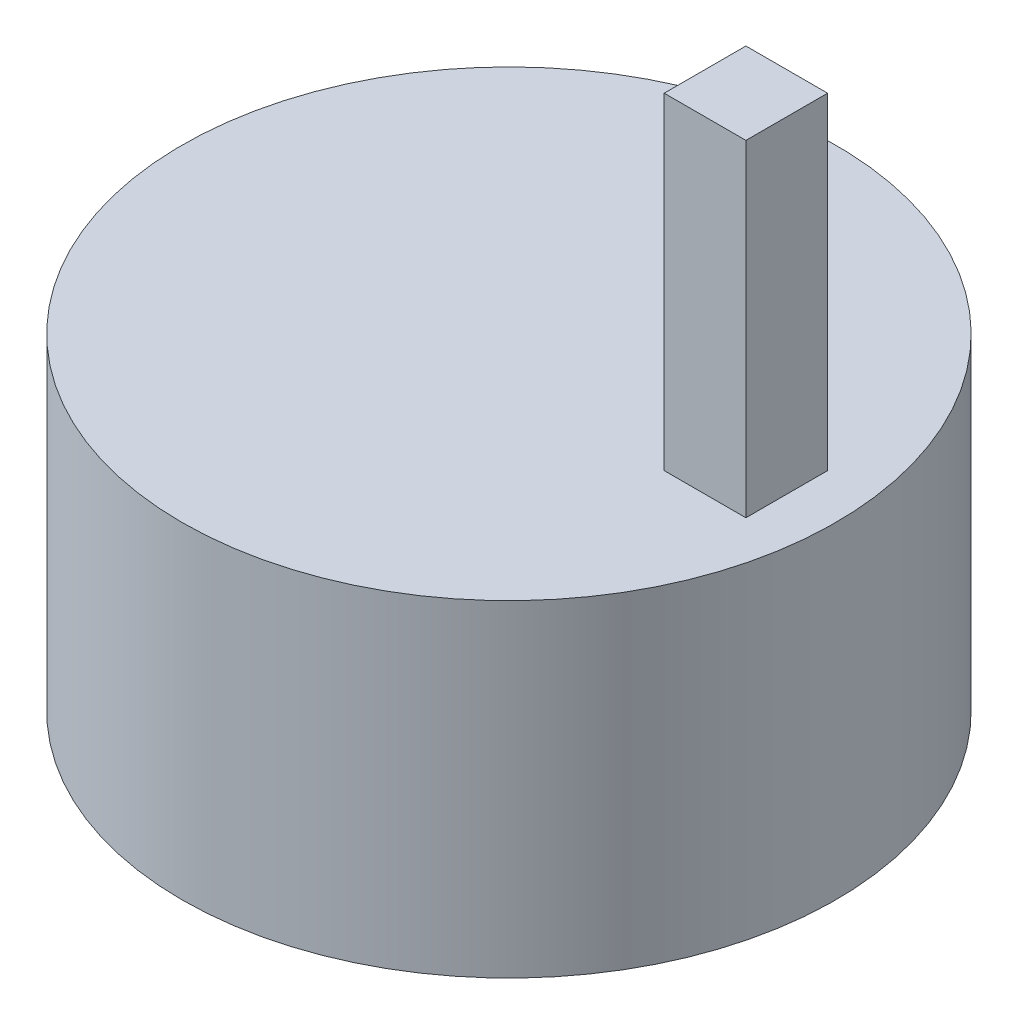
from build123d import *

# Parameters (mm, degrees)
SKETCH_1_R      = 20
EXTRUDE_1_DEPTH = 20
SKETCH_2_W      = 5
SKETCH_2_H      = 5
EXTRUDE_2_DEPTH = 20


with BuildPart() as part:
    # 草图1 → 凸台-拉伸1 (new body)
    with BuildSketch(Plane(origin=(0, 0, 0), x_dir=(1, 0, 0), z_dir=(0, 1, 0))):
        with Locations(Location((0, 0, 0), (0, 0, 270))):
            Circle(SKETCH_1_R)
    extrude(amount=EXTRUDE_1_DEPTH)

    # 草图2 → 凸台-拉伸2 (add)
    with BuildSketch(Plane(origin=(0, 20, 0), x_dir=(1, 0, 0), z_dir=(0, 1, 0))):
        with Locations((14.5, 0)):
            Rectangle(SKETCH_2_W, SKETCH_2_H)
    extrude(amount=EXTRUDE_2_DEPTH)


solid = part.part
